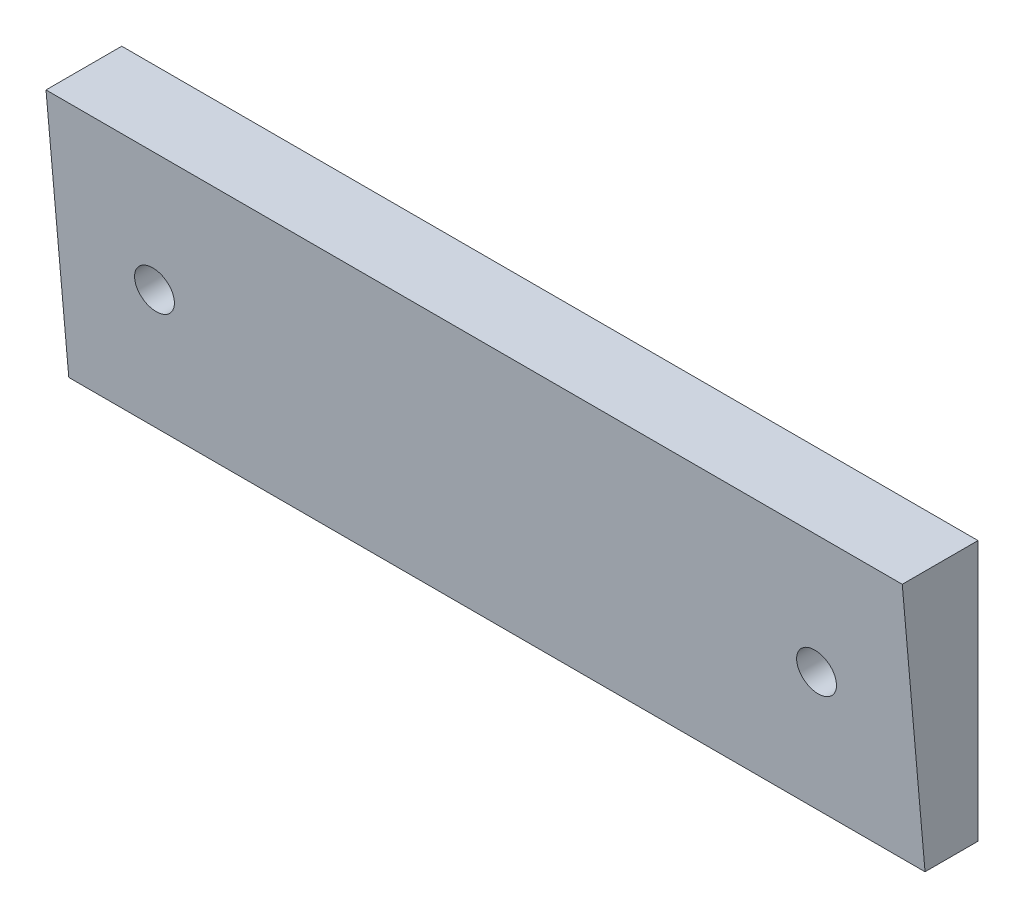
from build123d import *

# Parameters (mm, degrees)
EX_BODY_DEPTH        = 97
SK_INSERTS_M3_R      = 2
CUT_INSERTS_M3_DEPTH = 5.7
SK_VESA_M4_R         = 2.25
CUT_VESA_M4_DEPTH    = 12


with BuildPart() as part:
    # SK_Body → EX_Body (new body)
    with BuildSketch(Plane(origin=(-48.5, 0, 0), x_dir=(0, 0, -1), z_dir=(1, 0, 0))):
        Polygon((0, -19.5), (-6, -19.5), (-8.580915574, 10), (0, 10), align=None)
    extrude(amount=EX_BODY_DEPTH)

    # SK_Inserts_M3 → CUT_Inserts_M3 (cut)
    with BuildSketch(Plane.XY):
        with Locations((15, 0)):
            Circle(SK_INSERTS_M3_R)
        with Locations((-15, 0)):
            Circle(SK_INSERTS_M3_R)
    extrude(amount=CUT_INSERTS_M3_DEPTH, mode=Mode.SUBTRACT)

    # SK_VESA_M4 → CUT_VESA_M4 (cut)
    with BuildSketch(Plane.XY):
        with Locations((37.5, -4.75)):
            Circle(SK_VESA_M4_R)
        with Locations((-37.5, -4.75)):
            Circle(SK_VESA_M4_R)
    extrude(amount=CUT_VESA_M4_DEPTH, mode=Mode.SUBTRACT)


solid = part.part
